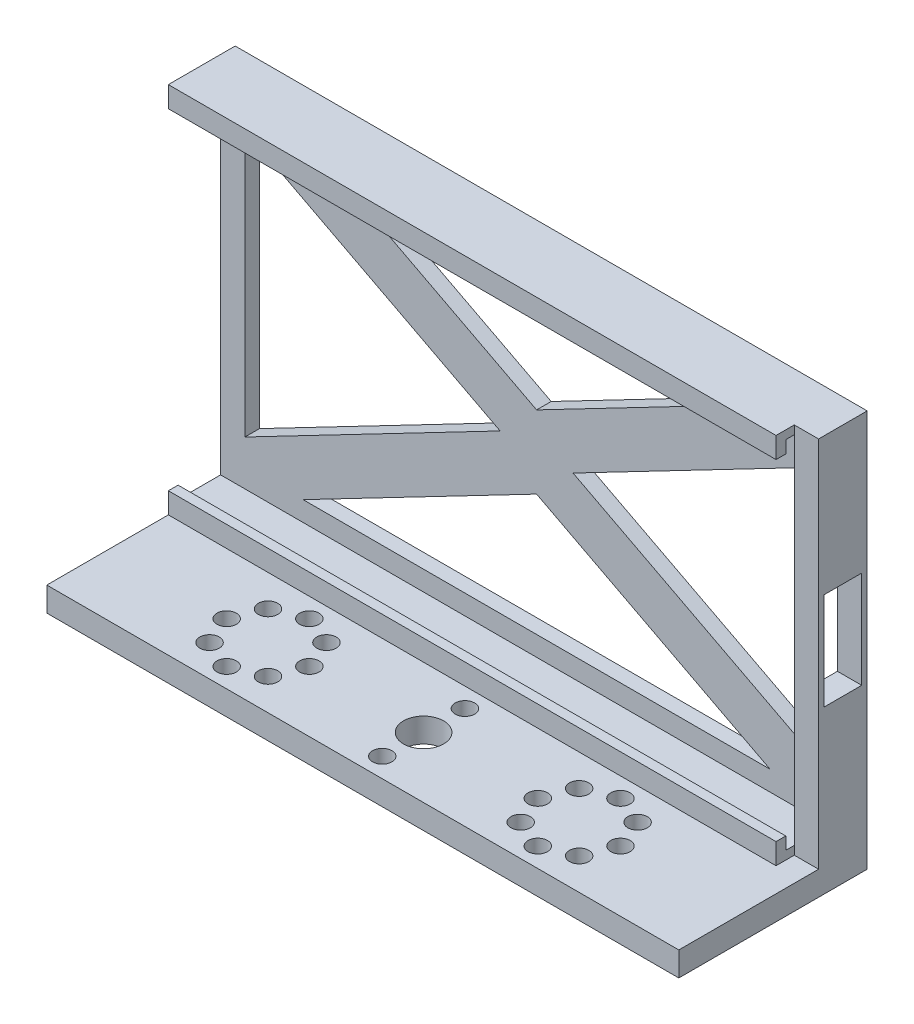
from build123d import *

# Parameters (mm, degrees)
BOSS_EXTRUDE1_DEPTH = 38.75
BOSS_EXTRUDE2_DEPTH = 3
SKETCH1_5_W         = 125
SKETCH1_5_H         = 1.75
BOSS_EXTRUDE3_DEPTH = 11.75
BOSS_EXTRUDE5_START = 11.75
SKETCH1_7_W         = 125
SKETCH1_7_H         = 4.3
BOSS_EXTRUDE5_DEPTH = 2
SKETCH2_R           = 2
SKETCH2_R_2         = 4.124206023
CUT_EXTRUDE1_DEPTH  = 13.75
SKETCH1_9_W         = 5
SKETCH1_9_H         = 76.65
BOSS_EXTRUDE7_DEPTH = 10
SKETCH3_W           = 7.75
SKETCH3_H           = 20
CUT_EXTRUDE2_DEPTH  = 10


with BuildPart() as part:
    # Sketch1 → Boss-Extrude1 (new body)
    with BuildSketch(Plane.XY):
        Polygon((65, -43.325), (65, -38.325), (60, -38.325), (-65, -38.325), (-65, -43.325), align=None)
    extrude(amount=BOSS_EXTRUDE1_DEPTH)

    # Sketch1<5> → Boss-Extrude3 (add)
    with BuildSketch(Plane.XY):
        with Locations((-2.5, 37.45)):
            Rectangle(SKETCH1_5_W, SKETCH1_5_H)
        with Locations((-2.5, -37.45)):
            Rectangle(SKETCH1_5_W, SKETCH1_5_H)
    extrude(amount=BOSS_EXTRUDE3_DEPTH)


with BuildPart() as body_2:
    # Sketch1<4> → Boss-Extrude2 (new body)
    with BuildSketch(Plane.XY):
        Polygon((60, 36.575), (-65, 36.575), (-65, -36.575), (60, -36.575), (60, -27.329770154), (7.5, 0), (60, 27.329770154), align=None)
        Polygon((48.024553174, 32.5), (0, 7.5), (-48.024553174, 32.5), align=None, mode=Mode.SUBTRACT)
        Polygon((-60, -27.329770154), (-60, 27.329770154), (-7.5, 0), align=None, mode=Mode.SUBTRACT)
        Polygon((48.024553174, -32.5), (-48.024553174, -32.5), (0, -7.5), align=None, mode=Mode.SUBTRACT)
    extrude(amount=BOSS_EXTRUDE2_DEPTH)



with BuildPart() as boss_extrude3_piece_1:
    # of the separate pieces the step leaves, piece 1, a body of its own (boss_extrude3_pieces)
    add(part.part.solids().sort_by_distance((65, -43.325, 0))[0])



with BuildPart() as boss_extrude3_piece_2:
    # of the separate pieces the step leaves, piece 2, a body of its own (boss_extrude3_pieces)
    add(part.part.solids().sort_by_distance((60, 36.575, 0))[0])


with BuildPart() as boss_extrude3_piece_1_1:
    add(boss_extrude3_piece_1.part)

    add(boss_extrude3_piece_2.part)  # Boss-Extrude5 merges Boss-Extrude3 piece 2
    # Sketch1<7> → Boss-Extrude5 (add)
    with BuildSketch(Plane.XY.offset(BOSS_EXTRUDE5_START)):
        with Locations((-2.5, 36.175)):
            Rectangle(SKETCH1_7_W, SKETCH1_7_H)
        with Locations((-2.5, -36.175)):
            Rectangle(SKETCH1_7_W, SKETCH1_7_H)
    extrude(amount=BOSS_EXTRUDE5_DEPTH)

    # Sketch2 → Cut-Extrude1 (cut)
    with BuildSketch(Plane.XZ.offset(43.325)):
        with Locations((32, 34.75)):
            Circle(SKETCH2_R)
        with Locations((23.5, 26.25)):
            Circle(SKETCH2_R)
        with Locations((0, 34.75)):
            Circle(SKETCH2_R)
        with Locations((0, 17.75)):
            Circle(SKETCH2_R)
        with Locations((0, 26.25)):
            Circle(SKETCH2_R_2)
        with Locations((38.01040764, 32.26040764)):
            Circle(SKETCH2_R)
        with Locations((40.5, 26.25)):
            Circle(SKETCH2_R)
        with Locations((38.01040764, 20.23959236)):
            Circle(SKETCH2_R)
        with Locations((32, 17.75)):
            Circle(SKETCH2_R)
        with Locations((25.98959236, 20.23959236)):
            Circle(SKETCH2_R)
        with Locations((25.98959236, 32.26040764)):
            Circle(SKETCH2_R)
        with Locations((-38.01040764, 20.23959236)):
            Circle(SKETCH2_R)
        with Locations((-32, 17.75)):
            Circle(SKETCH2_R)
        with Locations((-25.98959236, 20.23959236)):
            Circle(SKETCH2_R)
        with Locations((-23.5, 26.25)):
            Circle(SKETCH2_R)
        with Locations((-25.98959236, 32.26040764)):
            Circle(SKETCH2_R)
        with Locations((-32, 34.75)):
            Circle(SKETCH2_R)
        with Locations((-38.01040764, 32.26040764)):
            Circle(SKETCH2_R)
        with Locations((-40.5, 26.25)):
            Circle(SKETCH2_R)
    extrude(amount=-CUT_EXTRUDE1_DEPTH, mode=Mode.SUBTRACT)


with BuildPart() as body_2_1:
    add(body_2.part)

    add(boss_extrude3_piece_1_1.part)  # Boss-Extrude7 merges Boss-Extrude3 piece 1
    # Sketch1<9> → Boss-Extrude7 (add)
    with BuildSketch(Plane.XY):
        with Locations((62.5, 0)):
            Rectangle(SKETCH1_9_W, SKETCH1_9_H)
    extrude(amount=BOSS_EXTRUDE7_DEPTH)

    # Sketch3 → Cut-Extrude2 (cut)
    with BuildSketch(Plane(origin=(65, 0, 0), x_dir=(0, 0, -1), z_dir=(1, 0, 0))):
        with Locations((-5, 0)):
            Rectangle(SKETCH3_W, SKETCH3_H)
    extrude(amount=-CUT_EXTRUDE2_DEPTH, mode=Mode.SUBTRACT)


solid = body_2_1.part
